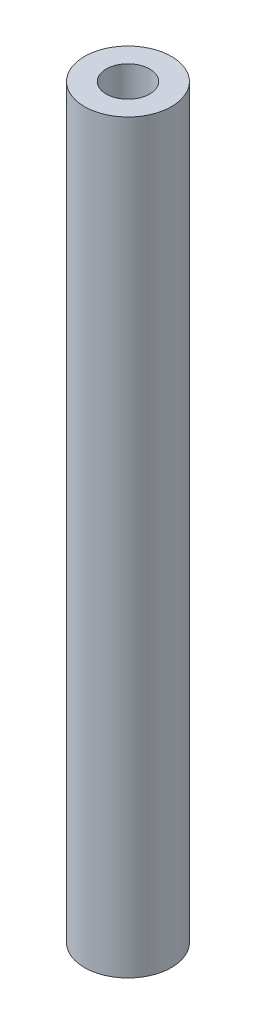
from build123d import *

# Parameters (mm, degrees)
SKETCH1_R           = 3.5
SKETCH1_R_2         = 1.75
BOSS_EXTRUDE1_DEPTH = 60


with BuildPart() as part:
    # Sketch1 → Boss-Extrude1 (new body)
    with BuildSketch(Plane(origin=(0, 0, 0), x_dir=(1, 0, 0), z_dir=(0, 1, 0))):
        with Locations(Location((0, 0, 0), (0, 0, 270))):
            Circle(SKETCH1_R)
        with Locations(Location((0, 0, 0), (0, 0, 270))):
            Circle(SKETCH1_R_2, mode=Mode.SUBTRACT)
    extrude(amount=BOSS_EXTRUDE1_DEPTH)


solid = part.part
